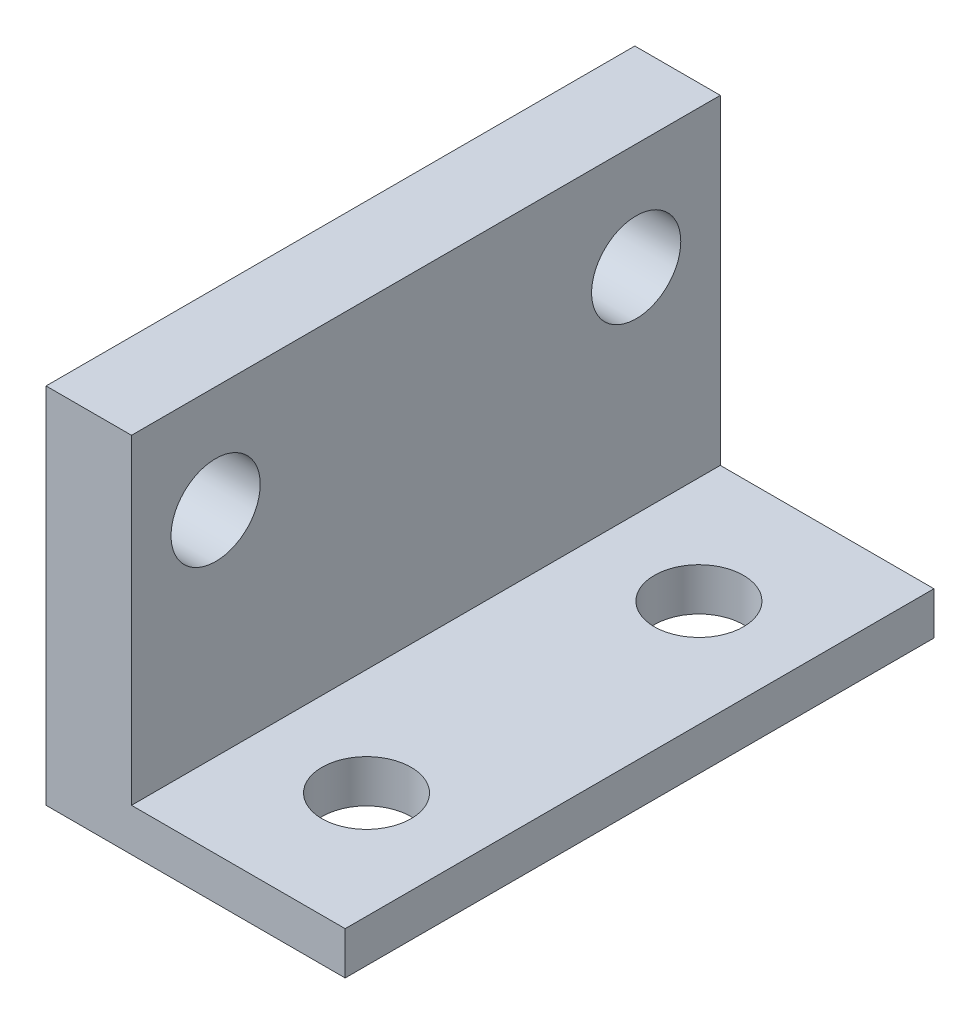
from build123d import *

# Parameters (mm, degrees)
SKETCH1_W             = 5.08
SKETCH1_H             = 19.05
BOSS_EXTRUDE1_DEPTH   = 35
F_5_0MM_DOWEL_HOLE1_D = 5.3
F_5_0MM_DOWEL_HOLE2_D = 5.3


with BuildPart() as part:
    # Sketch1 → Boss-Extrude1 (new body)
    with BuildSketch(Plane.XY):
        Polygon((0, 2.54), (0, 0), (17.78, 0), (17.78, 2.54), (5.08, 2.54), align=None)
        with Locations((2.54, 12.065)):
            Rectangle(SKETCH1_W, SKETCH1_H)
    extrude(amount=BOSS_EXTRUDE1_DEPTH)

    # Ø5.0mm Dowel Hole1 (through all)
    with Locations(Plane(origin=(5.08, 0, 0), x_dir=(0, 0, -1), z_dir=(1, 0, 0))):
        with Locations((-30, 15.24), (-5, 15.24)):
            Hole(F_5_0MM_DOWEL_HOLE1_D / 2)

    # Ø5.0mm Dowel Hole2 (through all)
    with Locations(Plane(origin=(0, 2.54, 0), x_dir=(1, 0, 0), z_dir=(0, 1, 0))):
        with Locations((11.43, -27.38), (11.43, -7.62)):
            Hole(F_5_0MM_DOWEL_HOLE2_D / 2)


solid = part.part
